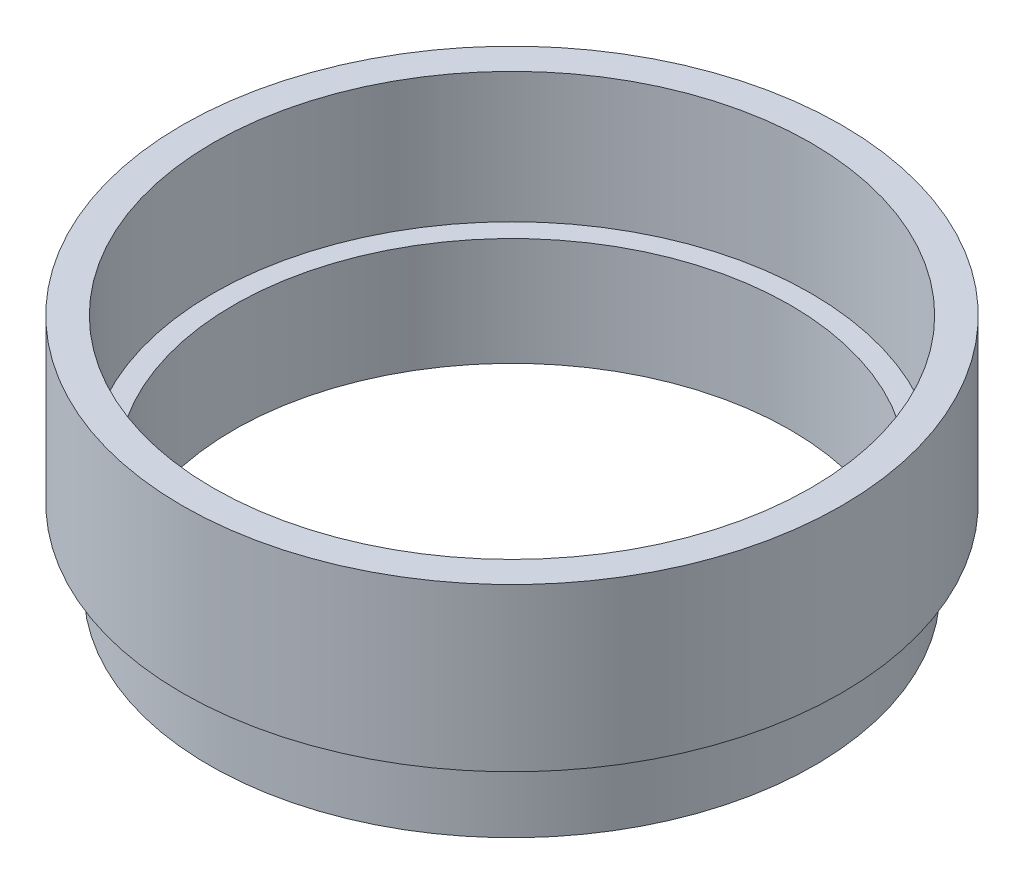
from build123d import *


with BuildPart() as part:
    # Sketch1 → Revolve1 (revolve)
    with BuildSketch(Plane.XY, mode=Mode.PRIVATE) as revolve1_sk:
        Polygon((-13.081, 0), (-14.224, 0), (-14.224, 3.5814), (-15.494, 3.5814), (-15.494, 11.2014), (-14.0462, 11.2014), (-14.0462, 5.08), (-13.081, 5.08), align=None)
    revolve(revolve1_sk.sketch.rotate(Axis((0, 0, 0), (0, 1, 0)), 270), axis=Axis((0, 0, 0), (0, 1, 0)))


solid = part.part
